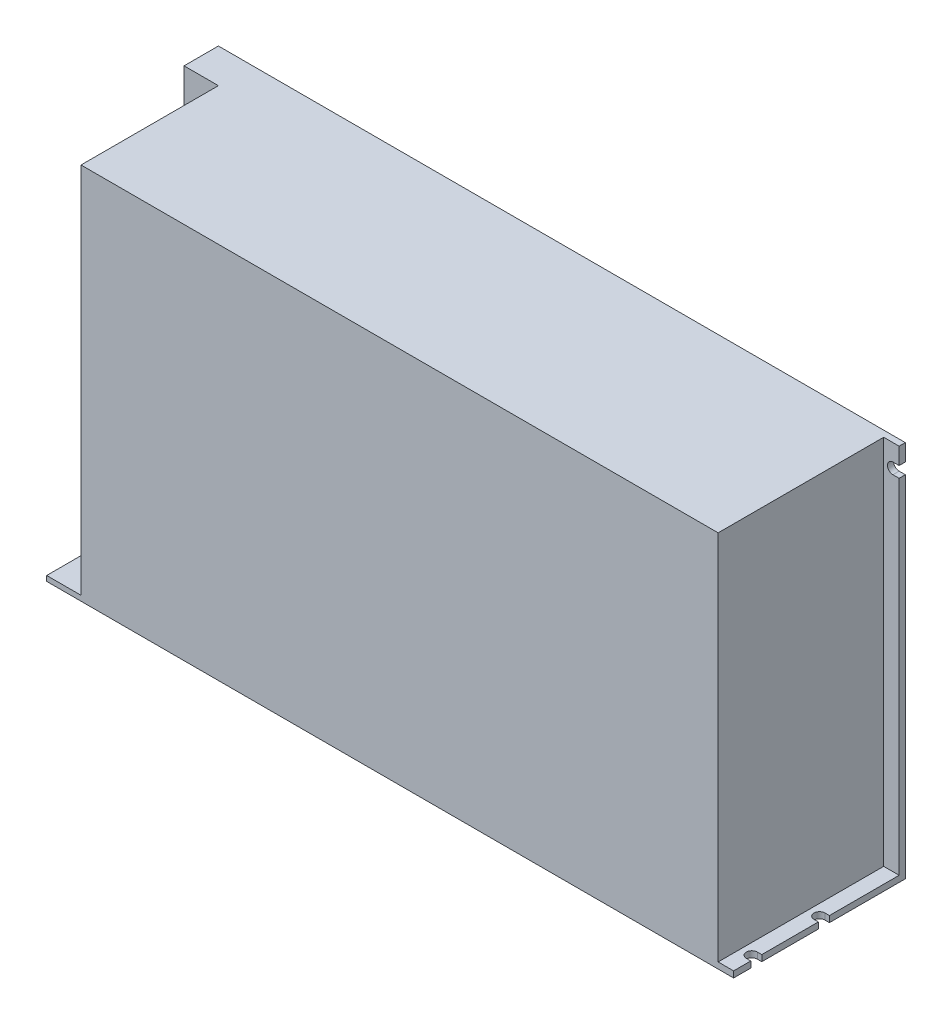
from build123d import *

# Parameters (mm, degrees)
SKETCH_1_W          = 200
SKETCH_1_H          = 110
EXTRUDE_1_DEPTH     = 50
SKETCH_2_R          = 2
CUT_EXTRUDE_1_DEPTH = 10
SKETCH_3_W          = 10
SKETCH_3_H          = 108.5
CUT_EXTRUDE_2_DEPTH = 40
SKETCH_6_W          = 4.5
SKETCH_6_H          = 48.2
CUT_EXTRUDE_5_DEPTH = 108.2
SKETCH_4_R          = 1.5
CUT_EXTRUDE_3_DEPTH = 10
SKETCH_5_R          = 1.6
CUT_EXTRUDE_4_DEPTH = 10
SKETCH_7_W          = 10
SKETCH_7_H          = 10
CUT_EXTRUDE_6_DEPTH = 8.2
SKETCH_8_R          = 1.6
CUT_EXTRUDE_7_DEPTH = 1.8


with BuildPart() as part:
    # 草图1 → 拉伸1 (new body)
    with BuildSketch(Plane.XY):
        with Locations((-22.033224223, 5.842062193)):
            Rectangle(SKETCH_1_W, SKETCH_1_H)
    extrude(amount=EXTRUDE_1_DEPTH)

    # 草图2 → 切除-拉伸1 (cut)
    with BuildSketch(Plane.XY):
        with Locations((-60.533224223, 50.842062193)):
            Circle(SKETCH_2_R)
        with Locations((65.466775777, 50.842062193)):
            Circle(SKETCH_2_R)
        with Locations((-60.533224223, -34.157937807)):
            Circle(SKETCH_2_R)
        with Locations((65.466775777, -34.157937807)):
            Circle(SKETCH_2_R)
    extrude(amount=CUT_EXTRUDE_1_DEPTH, mode=Mode.SUBTRACT)

    # 草图3 → 切除-拉伸2 (cut)
    with BuildSketch(Plane.XY.offset(50)):
        with Locations((-117.033224223, 6.592062193)):
            Rectangle(SKETCH_3_W, SKETCH_3_H)
    extrude(amount=-CUT_EXTRUDE_2_DEPTH, mode=Mode.SUBTRACT)

    # 草图6 → 切除-拉伸5 (cut)
    with BuildSketch(Plane(origin=(0, 60.842062193, 0), x_dir=(-1, 0, 0), z_dir=(0, 1, 0))):
        with Locations((-75.716775777, 25.9)):
            Rectangle(SKETCH_6_W, SKETCH_6_H)
    extrude(amount=-CUT_EXTRUDE_5_DEPTH, mode=Mode.SUBTRACT)

    # 草图4 → 切除-拉伸3 (cut)
    with BuildSketch(Plane.XZ.offset(49.157937807)):
        with Locations(Location((-116.033224223, 13, 0), (0, 0, 270))):
            Circle(SKETCH_4_R)
        with Locations(Location((56.966775777, 13, 0), (0, 0, 270))):
            Circle(SKETCH_4_R)
        with Locations(Location((56.966775777, 38, 0), (0, 0, 270))):
            Circle(SKETCH_4_R)
    extrude(amount=-CUT_EXTRUDE_3_DEPTH, mode=Mode.SUBTRACT)

    # 草图5 → 切除-拉伸4 (cut)
    with BuildSketch(Plane.XZ.offset(49.157937807)):
        with Locations(Location((-116.033224223, 33, 0), (0, 0, 270))):
            Circle(SKETCH_5_R)
        with BuildLine():
            Line((77.966775777, 45), (77.966775777, 41.8))
            Line((77.966775777, 41.8), (76.666775777, 41.8))
            ThreePointArc((76.666775777, 41.8), (75.066775777, 43.4), (76.666775777, 45))
            Line((76.666775777, 45), (77.966775777, 45))
        make_face()
        with BuildLine():
            Line((77.966775777, 22.1), (76.666775777, 22.1))
            ThreePointArc((76.666775777, 22.1), (75.066775777, 23.7), (76.666775777, 25.3))
            Line((76.666775777, 25.3), (77.966775777, 25.3))
            Line((77.966775777, 25.3), (77.966775777, 22.1))
        make_face()
    extrude(amount=-CUT_EXTRUDE_4_DEPTH, mode=Mode.SUBTRACT)

    # 草图7 → 切除-拉伸6 (cut)
    with BuildSketch(Plane.XY.offset(10)):
        with Locations((-117.033224223, -42.657937807)):
            Rectangle(SKETCH_7_W, SKETCH_7_H)
    extrude(amount=-CUT_EXTRUDE_6_DEPTH, mode=Mode.SUBTRACT)

    # 草图8 → 切除-拉伸7 (cut)
    with BuildSketch(Plane(origin=(0, 0, 0), x_dir=(-1, 0, 0), z_dir=(0, 0, -1))):
        with Locations((118.533224223, -41.157937807)):
            Circle(SKETCH_8_R)
        with BuildLine():
            Line((-77.966775777, 55.942062193), (-76.166775777, 55.942062193))
            ThreePointArc((-76.166775777, 55.942062193), (-74.566775777, 54.342062193), (-76.166775777, 52.742062193))
            Line((-76.166775777, 52.742062193), (-77.966775777, 52.742062193))
            Line((-77.966775777, 52.742062193), (-77.966775777, 55.942062193))
        make_face()
    extrude(amount=-CUT_EXTRUDE_7_DEPTH, mode=Mode.SUBTRACT)


solid = part.part
